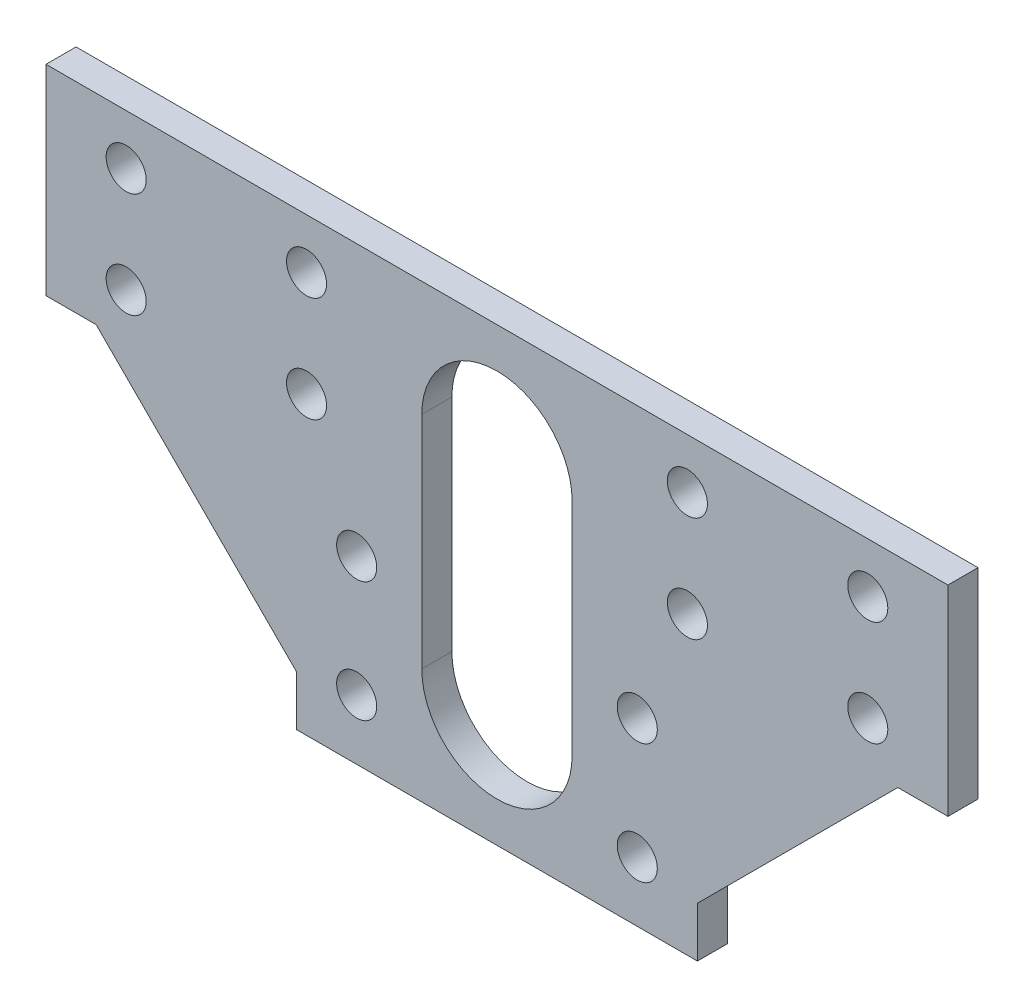
from build123d import *

# Parameters (mm, degrees)
EXTRUDE_1_DEPTH     = 3
SKETCH_2_R          = 2
CUT_EXTRUDE_1_DEPTH = 3


with BuildPart() as part:
    # 草图1 → 凸台-拉伸1 (new body)
    with BuildSketch(Plane.XY):
        Polygon((0, 0), (90, 0), (90, -20), (85, -20), (65, -40), (65, -45), (25, -45), (25, -40), (5, -20), (0, -20), align=None)
    extrude(amount=EXTRUDE_1_DEPTH)

    # 草图2 → 切除-拉伸1 (cut)
    with BuildSketch(Plane.XY.offset(3)):
        with Locations((82, -5)):
            Circle(SKETCH_2_R)
        with Locations((82, -15.5)):
            Circle(SKETCH_2_R)
        with Locations((64, -15.5)):
            Circle(SKETCH_2_R)
        with Locations((64, -5)):
            Circle(SKETCH_2_R)
        with Locations((26, -5)):
            Circle(SKETCH_2_R)
        with Locations((26, -15.5)):
            Circle(SKETCH_2_R)
        with Locations((8, -5)):
            Circle(SKETCH_2_R)
        with Locations((8, -15.5)):
            Circle(SKETCH_2_R)
        with Locations((31, -27)):
            Circle(SKETCH_2_R)
        with Locations((31, -39)):
            Circle(SKETCH_2_R)
        with Locations((59, -27)):
            Circle(SKETCH_2_R)
        with Locations((59, -39)):
            Circle(SKETCH_2_R)
        with BuildLine():
            Line((52.5, -11.5), (52.5, -33.5))
            ThreePointArc((52.5, -33.5), (45, -41), (37.5, -33.5))
            Line((37.5, -33.5), (37.5, -11.5))
            ThreePointArc((37.5, -11.5), (45, -4), (52.5, -11.5))
        make_face()
    extrude(amount=-CUT_EXTRUDE_1_DEPTH, mode=Mode.SUBTRACT)


solid = part.part
